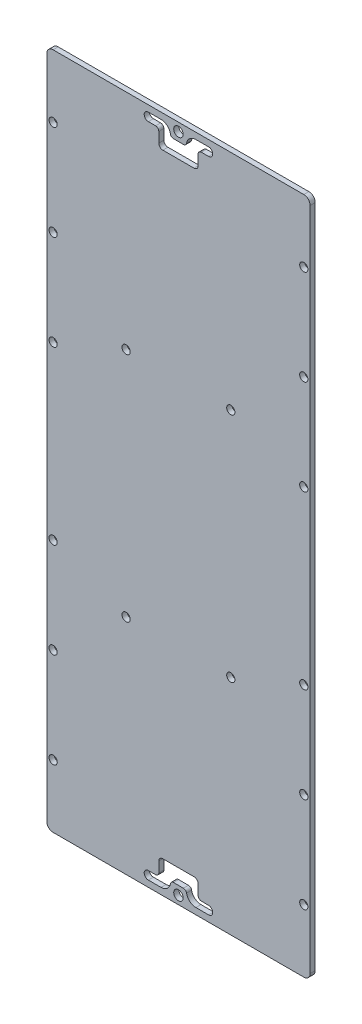
from build123d import *

# Parameters (mm, degrees)
BOSS_EXTRUDE2_DEPTH = 1.6
MODEL_3_R           = 1.3
MODEL_3_R_2         = 1.5
CUT_EXTRUDE2_DEPTH  = 1.6


with BuildPart() as part:
    # Model → Boss-Extrude2 (new body)
    with BuildSketch(Plane.XY):
        with BuildLine():
            Line((2, 213.8), (81, 213.8))
            ThreePointArc((81, 213.8), (82.414213562, 213.214213562), (83, 211.8))
            Line((83, 211.8), (83, 2.2))
            ThreePointArc((83, 2.2), (82.414213562, 0.785786438), (81, 0.2))
            Line((81, 0.2), (2, 0.2))
            ThreePointArc((2, 0.2), (0.585786438, 0.785786438), (0, 2.2))
            Line((0, 2.2), (0, 211.8))
            ThreePointArc((0, 211.8), (0.585786438, 213.214213562), (2, 213.8))
        make_face()
    extrude(amount=BOSS_EXTRUDE2_DEPTH)

    # Model<3> → Cut-Extrude2 (cut)
    with BuildSketch(Plane.XY):
        with Locations((58, 143.5)):
            Circle(MODEL_3_R)
        with Locations((25, 143.5)):
            Circle(MODEL_3_R)
        with Locations((41.5, 211.2)):
            Circle(MODEL_3_R_2)
        with Locations((41.5, 2.8)):
            Circle(MODEL_3_R_2)
        with Locations((2, 194)):
            Circle(MODEL_3_R)
        with Locations((2, 164)):
            Circle(MODEL_3_R)
        with Locations((2, 134)):
            Circle(MODEL_3_R)
        with Locations((81, 194)):
            Circle(MODEL_3_R)
        with Locations((81, 164)):
            Circle(MODEL_3_R)
        with Locations((81, 134)):
            Circle(MODEL_3_R)
        with Locations((81, 80)):
            Circle(MODEL_3_R)
        with Locations((81, 50)):
            Circle(MODEL_3_R)
        with Locations((81, 20)):
            Circle(MODEL_3_R)
        with Locations((2, 20)):
            Circle(MODEL_3_R)
        with Locations((2, 50)):
            Circle(MODEL_3_R)
        with Locations((2, 80)):
            Circle(MODEL_3_R)
        with Locations((58, 70.5)):
            Circle(MODEL_3_R)
        with Locations((25, 70.5)):
            Circle(MODEL_3_R)
        with BuildLine():
            Line((51, 2.2), (47, 2.2))
            ThreePointArc((47, 2.2), (45.073215113, 2.900543542), (44.0462947, 4.675))
            ThreePointArc((44.0462947, 4.675), (43.703987895, 5.266485486), (43.061726266, 5.5))
            Line((43.061726266, 5.5), (39.938273733, 5.5))
            ThreePointArc((39.938273733, 5.5), (39.296012105, 5.266485486), (38.9537053, 4.675))
            ThreePointArc((38.9537053, 4.675), (37.926784887, 2.900543542), (36, 2.2))
            Line((36, 2.2), (32, 2.2))
            ThreePointArc((32, 2.2), (30.7, 3.5), (32, 4.8))
            Line((32, 4.8), (34.3, 4.8))
            ThreePointArc((34.3, 4.8), (35.007106781, 5.092893219), (35.3, 5.8))
            Line((35.3, 5.8), (35.3, 9.03))
            ThreePointArc((35.3, 9.03), (35.671974388, 9.928025612), (36.57, 10.3))
            Line((36.57, 10.3), (46.43, 10.3))
            ThreePointArc((46.43, 10.3), (47.328025612, 9.928025612), (47.7, 9.03))
            Line((47.7, 9.03), (47.7, 5.8))
            ThreePointArc((47.7, 5.8), (47.992893219, 5.092893219), (48.7, 4.8))
            Line((48.7, 4.8), (51, 4.8))
            ThreePointArc((51, 4.8), (52.3, 3.5), (51, 2.2))
        make_face()
        with BuildLine():
            Line((36, 211.8), (32, 211.8))
            ThreePointArc((32, 211.8), (30.7, 210.5), (32, 209.2))
            Line((32, 209.2), (34.3, 209.2))
            ThreePointArc((34.3, 209.2), (35.007106781, 208.907106781), (35.3, 208.2))
            Line((35.3, 208.2), (35.3, 204.97))
            ThreePointArc((35.3, 204.97), (35.671974388, 204.071974388), (36.57, 203.7))
            Line((36.57, 203.7), (46.43, 203.7))
            ThreePointArc((46.43, 203.7), (47.328025612, 204.071974388), (47.7, 204.97))
            Line((47.7, 204.97), (47.7, 208.2))
            ThreePointArc((47.7, 208.2), (47.992893219, 208.907106781), (48.7, 209.2))
            Line((48.7, 209.2), (51, 209.2))
            ThreePointArc((51, 209.2), (52.3, 210.5), (51, 211.8))
            Line((51, 211.8), (47, 211.8))
            ThreePointArc((47, 211.8), (45.073215113, 211.099456458), (44.0462947, 209.325))
            ThreePointArc((44.0462947, 209.325), (43.703987895, 208.733514514), (43.061726267, 208.5))
            Line((43.061726267, 208.5), (39.938273734, 208.5))
            ThreePointArc((39.938273734, 208.5), (39.296012105, 208.733514514), (38.9537053, 209.325))
            ThreePointArc((38.9537053, 209.325), (37.926784887, 211.099456458), (36, 211.8))
        make_face()
    extrude(amount=CUT_EXTRUDE2_DEPTH, mode=Mode.SUBTRACT)


solid = part.part
